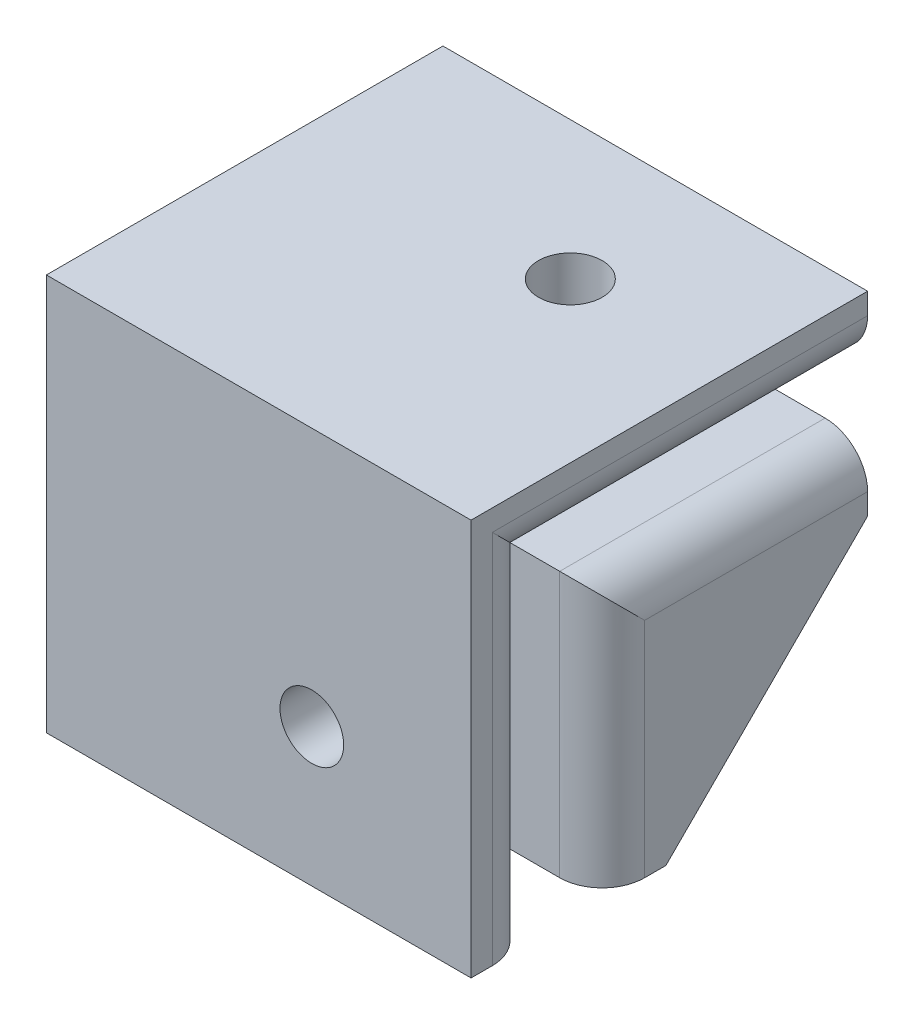
from build123d import *

# Parameters (mm, degrees)
BOSS_EXTRUDE1_DEPTH = 20
CUT_EXTRUDE1_DEPTH  = 15
FILLET1_R           = 2
SKETCH3_R           = 1.5
CUT_EXTRUDE2_DEPTH  = 31.083311404
SKETCH4_R           = 1.5
CUT_EXTRUDE3_DEPTH  = 31.083311404
SCALE1_SCALE        = 1.02


with BuildPart() as part:
    # Sketch1 → Boss-Extrude1 (new body)
    with BuildSketch(Plane(origin=(0, 0, 0), x_dir=(0, 0, -1), z_dir=(1, 0, 0))):
        Polygon((0, -12.5), (-3.175, -12.5), (-6.175, -12.5), (-6.175, 6.175), (12.5, 6.175), (12.5, 3.175), (12.5, 0), (12.5, -3), (3, -12.5), align=None)
    extrude(amount=BOSS_EXTRUDE1_DEPTH)

    # Sketch2 → Cut-Extrude1 (cut)
    with BuildSketch(Plane(origin=(20, 0, 0), x_dir=(0, 0, -1), z_dir=(1, 0, 0))):
        Polygon((-3.175, -12.5), (0, -12.5), (0, 0), (12.5, 0), (12.5, 3.175), (-3.175, 3.175), align=None)
    extrude(amount=-CUT_EXTRUDE1_DEPTH, mode=Mode.SUBTRACT)

    # Fillet1
    fillet1_edges = [part.edges().sort_by_distance(p)[0] for p in [
        (20, -4.6625, 3.175),
        (20, -6.25, 0),
        (20, 0, -6.25),
        (20, 3.175, -4.6625),
    ]]
    fillet(fillet1_edges, radius=FILLET1_R)

    # Sketch3 → Cut-Extrude2 (cut, through all)
    with BuildSketch(Plane(origin=(0, 6.175, 0), x_dir=(1, 0, 0), z_dir=(0, 1, 0))):
        with Locations(Location((12.5, 6, 0), (0, 0, 90))):
            Circle(SKETCH3_R)
    extrude(amount=-CUT_EXTRUDE2_DEPTH, mode=Mode.SUBTRACT)

    # Sketch4 → Cut-Extrude3 (cut, through all)
    with BuildSketch(Plane.XY.offset(6.175)):
        with Locations((12.5, -6)):
            Circle(SKETCH4_R)
    extrude(amount=-CUT_EXTRUDE3_DEPTH, mode=Mode.SUBTRACT)


with BuildPart() as part_1:
    # Scale1: scaled about (9.068575954, -2.293993837, -2.293993837)
    add(part.part.scale(SCALE1_SCALE).moved(Location((-0.181371519, 0.045879877, 0.045879877))))


solid = part_1.part
